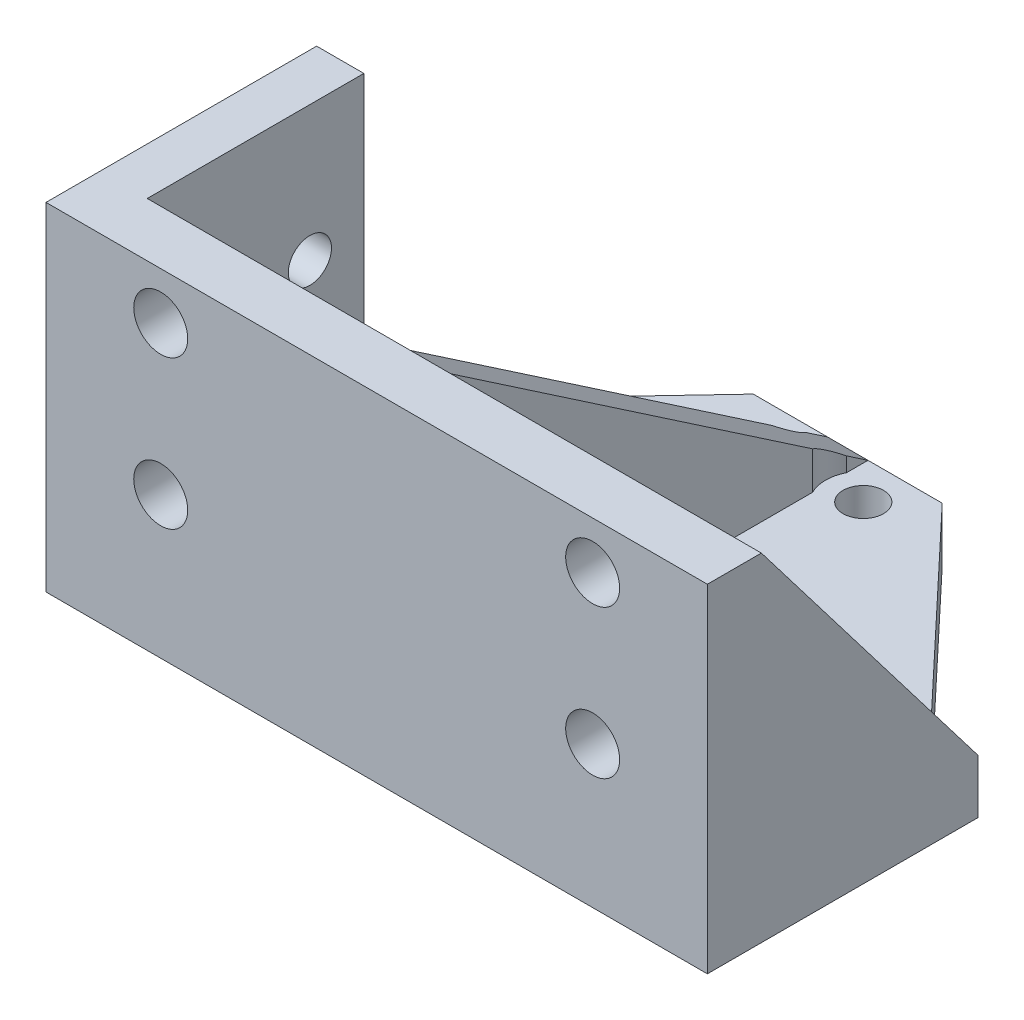
from build123d import *

# Parameters (mm, degrees)
EXTRUDE_1_DEPTH      = 49
SKETCH_3_R           = 1.5
CUT_EXTRUDE_1_DEPTH  = 64.718207759
EXTRUDE_3_DEPTH      = 3.5
EXTRUDE_4_DEPTH      = 3.5
EXTRUDE_5_DEPTH      = 1.5
EXTRUDE_5_DEPTH_BACK = 1.5
SKETCH_8_R           = 2
CUT_EXTRUDE_2_DEPTH  = 10
CUT_EXTRUDE_3_REACH  = 67.146
EXTRUDE_6_DEPTH      = 3.5
SKETCH_11_R          = 1.6
CUT_EXTRUDE_4_DEPTH  = 10


with BuildPart() as part:
    # 草图1 → 凸台-拉伸1 (new body)
    with BuildSketch(Plane(origin=(0, 0, 0), x_dir=(0, 0, -1), z_dir=(1, 0, 0))):
        Polygon((0, 0), (0, 25), (4, 25), (4, 4), (34.9, 4), (34.9, 0), align=None)
    extrude(amount=EXTRUDE_1_DEPTH)

    # 草图3 → 切除-拉伸1 (cut, through all)
    with BuildSketch(Plane(origin=(0, 4, 0), x_dir=(1, 0, 0), z_dir=(0, 1, 0))):
        with Locations(Location((20.5, 32.05, 0), (0, 0, 270))):
            Circle(SKETCH_3_R)
        with Locations(Location((28.5, 32.05, 0), (0, 0, 90))):
            Circle(SKETCH_3_R)
        with Locations(Location((42.5, 15.55, 0), (0, 0, 270))):
            Circle(SKETCH_3_R)
        with Locations(Location((6.5, 15.55, 0), (0, 0, 90))):
            Circle(SKETCH_3_R)
        with Locations(Location((29.5, 8.55, 0), (0, 0, 270))):
            Circle(SKETCH_3_R)
        with Locations(Location((19.5, 8.55, 0), (0, 0, 90))):
            Circle(SKETCH_3_R)
        Polygon((31.5, 34.9), (45.5, 20.05), (49, 20.05), (49, 34.9), align=None)
        Polygon((0, 20.05), (0, 34.9), (17.5, 34.9), (3.5, 20.05), align=None)
    extrude(amount=-CUT_EXTRUDE_1_DEPTH, mode=Mode.SUBTRACT)

    # 草图5 → 凸台-拉伸3 (add)
    with BuildSketch(Plane(origin=(49, 0, 0), x_dir=(0, 0, -1), z_dir=(1, 0, 0))):
        Polygon((20.05, 0), (20.05, 4), (4, 25), (0, 25), (0, 0), align=None)
    extrude(amount=-EXTRUDE_3_DEPTH)

    # 草图6 → 凸台-拉伸4 (add)
    with BuildSketch(Plane.ZY):
        Polygon((-4, 25), (0, 25), (0, 0), (-20.05, 0), (-20.05, 4), align=None)
    extrude(amount=-EXTRUDE_4_DEPTH)

    # 草图7 → 凸台-拉伸5 (add, two sides: drawn at the far end of the back side and taken through both)
    with BuildSketch(Plane(origin=(24.5, 0, 0), x_dir=(0, 0, -1), z_dir=(1, 0, 0)).offset(-EXTRUDE_5_DEPTH_BACK)):
        Polygon((34.9, 4), (34.9, 0), (0, 0), (0, 25), (4, 25), align=None)
    extrude(amount=EXTRUDE_5_DEPTH + EXTRUDE_5_DEPTH_BACK)

    # 草图8 → 切除-拉伸2 (cut)
    with BuildSketch(Plane(origin=(0, 0, -4), x_dir=(-1, 0, 0), z_dir=(0, 0, -1))):
        with Locations(Location((-8.5, 21.5, 0), (0, 0, 90))):
            Circle(SKETCH_8_R)
        with Locations(Location((-8.5, 10.5, 0), (0, 0, 90))):
            Circle(SKETCH_8_R)
        with Locations(Location((-40.5, 10.5, 0), (0, 0, 90))):
            Circle(SKETCH_8_R)
        with Locations(Location((-40.5, 21.5, 0), (0, 0, 90))):
            Circle(SKETCH_8_R)
    extrude(amount=-CUT_EXTRUDE_2_DEPTH, mode=Mode.SUBTRACT)

    # 切除-拉伸3: up to this face of the body (flat: up to its plane)
    cut_extrude_3_end = Plane(part.part.faces().sort_by_distance((34.743076347, 4, -17.196256648))[0])
    # 草图9 → 切除-拉伸3 (cut, up to the picked face)
    with BuildSketch(Plane(origin=(0, 25, 0), x_dir=(1, 0, 0), z_dir=(0, 1, 0)), mode=Mode.PRIVATE) as cut_extrude_3_sk1:
        with BuildLine():
            Line((26, 33.310952021), (26, 30.789047979))
            ThreePointArc((26, 30.789047979), (25.7, 32.05), (26, 33.310952021))
        make_face()
    cut_extrude_3_tool1 = split(extrude(cut_extrude_3_sk1.sketch, amount=-CUT_EXTRUDE_3_REACH, mode=Mode.PRIVATE), bisect_by=cut_extrude_3_end, keep=Keep.BOTH, mode=Mode.PRIVATE)
    # 草图9 → 切除-拉伸3 (cut, up to the picked face)
    with BuildSketch(Plane(origin=(0, 25, 0), x_dir=(1, 0, 0), z_dir=(0, 1, 0)), mode=Mode.PRIVATE) as cut_extrude_3_sk2:
        with BuildLine():
            Line((23, 33.310952021), (23, 30.789047979))
            ThreePointArc((23, 30.789047979), (23.3, 32.05), (23, 33.310952021))
        make_face()
    cut_extrude_3_tool2 = split(extrude(cut_extrude_3_sk2.sketch, amount=-CUT_EXTRUDE_3_REACH, mode=Mode.PRIVATE), bisect_by=cut_extrude_3_end, keep=Keep.BOTH, mode=Mode.PRIVATE)
    add(cut_extrude_3_tool1.solids().sort_by(Axis((25.879431, 25, -32.05), (0, -1, 0)))[0], mode=Mode.SUBTRACT)
    add(cut_extrude_3_tool2.solids().sort_by(Axis((23.120569, 25, -32.05), (0, -1, 0)))[0], mode=Mode.SUBTRACT)

    # 草图10 → 凸台-拉伸6 (add)
    with BuildSketch(Plane(origin=(3.5, 0, 0), x_dir=(0, 0, -1), z_dir=(1, 0, 0))):
        Polygon((20.05, 4), (4, 25), (20.05, 25), align=None)
    extrude(amount=-EXTRUDE_6_DEPTH)

    # 草图11 → 切除-拉伸4 (cut)
    with BuildSketch(Plane.ZY):
        with Locations((-8.05, 15)):
            Circle(SKETCH_11_R)
        with Locations((-16.05, 15)):
            Circle(SKETCH_11_R)
    extrude(amount=-CUT_EXTRUDE_4_DEPTH, mode=Mode.SUBTRACT)


solid = part.part
